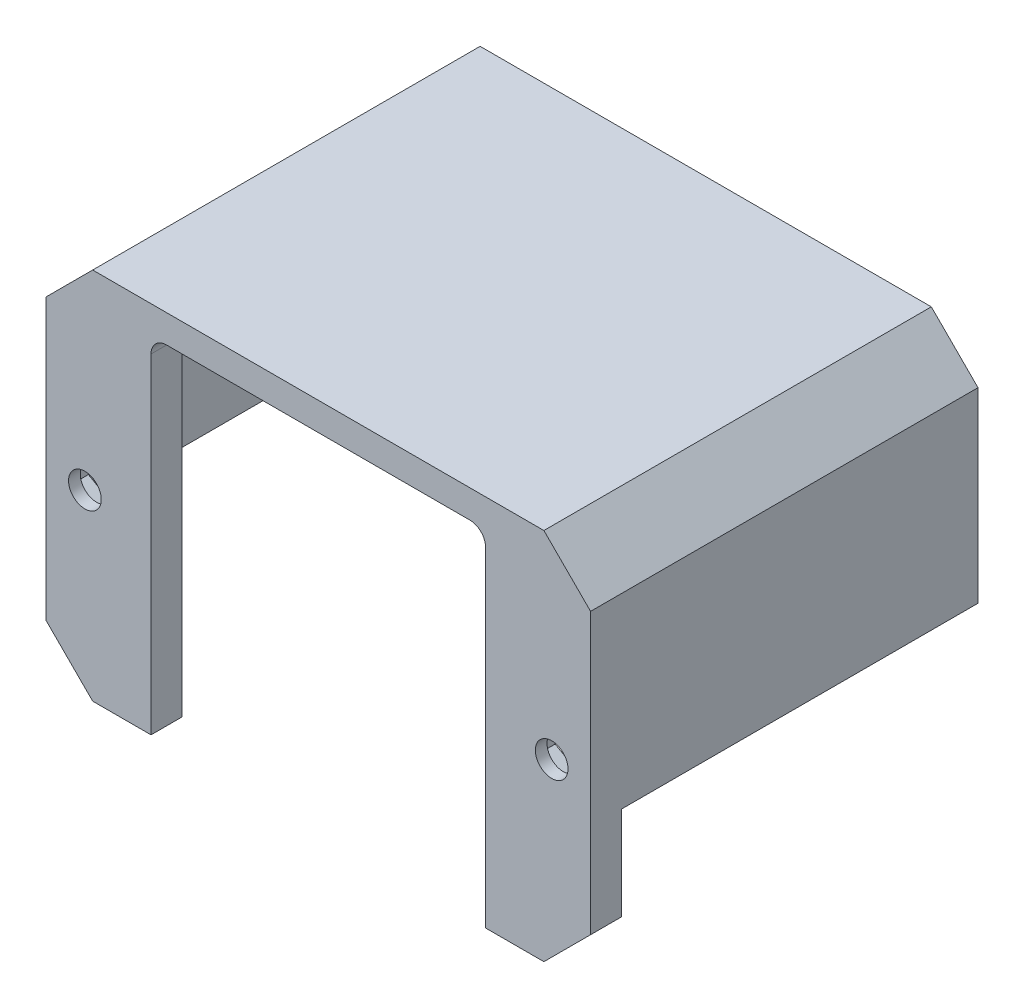
from build123d import *

# Parameters (mm, degrees)
SKETCH1_W           = 70
SKETCH1_H           = 48
SKETCH1_W_2         = 43
SKETCH1_H_2         = 42.8
BOSS_EXTRUDE1_DEPTH = 4
SKETCH2_W           = 10.268328243
SKETCH2_H           = 48
SKETCH2_R           = 2.1
SKETCH2_W_2         = 10.814622491
BOSS_EXTRUDE2_DEPTH = 1.5
CHAMFER1_SIZE       = 6
FILLET1_R           = 2
SKETCH3_W           = 43
SKETCH3_H           = 7.264710946
CUT_EXTRUDE1_DEPTH  = 10
BOSS_EXTRUDE3_DEPTH = 45.8
BOSS_EXTRUDE4_DEPTH = 1.2
CUT_EXTRUDE2_DEPTH  = 50


with BuildPart() as part:
    # Sketch1 → Boss-Extrude1 (new body)
    with BuildSketch(Plane(origin=(0, 0, 789.620141885), x_dir=(-1, 0, 0), z_dir=(0, 0, -1))):
        with Locations((-51.439156386, -559.298939869)):
            Rectangle(SKETCH1_W, SKETCH1_H)
        with Locations((-51.439156386, -560.298939869)):
            Rectangle(SKETCH1_W_2, SKETCH1_H_2, mode=Mode.SUBTRACT)
        Polygon((-84.989156386, -558.249346414), (-84.989156386, -562.348533325), (-81.439156386, -564.398126781), (-77.889156386, -562.348533325), (-77.889156386, -558.249346414), (-81.439156386, -556.199752958), align=None, mode=Mode.SUBTRACT)
        Polygon((-17.889156386, -562.348533325), (-17.889156386, -558.249346414), (-21.439156386, -556.199752958), (-24.989156386, -558.249346414), (-24.989156386, -562.348533325), (-21.439156386, -564.398126781), align=None, mode=Mode.SUBTRACT)
    extrude(amount=BOSS_EXTRUDE1_DEPTH)

    # Sketch2 → Boss-Extrude2 (add)
    # profile 1 of 2: a face of its own
    with BuildSketch(Plane.XY.offset(789.620141885)):
        with Locations((21.573320508, -559.298939869)):
            Rectangle(SKETCH2_W, SKETCH2_H)
        with Locations((21.439156386, -560.298939869)):
            Circle(SKETCH2_R, mode=Mode.SUBTRACT)
    # profile 2 of 2: a face of its own
    with BuildSketch(Plane.XY.offset(789.620141885)):
        with Locations((81.03184514, -559.298939869)):
            Rectangle(SKETCH2_W_2, SKETCH2_H)
        with Locations((81.439156386, -560.298939869)):
            Circle(SKETCH2_R, mode=Mode.SUBTRACT)
    extrude(amount=-BOSS_EXTRUDE2_DEPTH)

    # Chamfer1
    chamfer1_edges = [part.edges().sort_by_distance(p)[0] for p in [
        (86.439156386, -535.298939869, 787.620141885),
        (16.439156386, -535.298939869, 787.620141885),
        (16.439156386, -583.298939869, 787.620141885),
        (86.439156386, -583.298939869, 787.620141885),
    ]]
    chamfer(chamfer1_edges, length=CHAMFER1_SIZE)

    # Fillet1
    fillet1_edges = [part.edges().sort_by_distance(p)[0] for p in [
        (72.939156386, -538.898939869, 787.620141885),
        (29.939156386, -538.898939869, 787.620141885),
    ]]
    fillet(fillet1_edges, radius=FILLET1_R)

    # Sketch3 → Cut-Extrude1 (cut)
    with BuildSketch(Plane(origin=(0, 0, 785.620141885), x_dir=(-1, 0, 0), z_dir=(0, 0, -1))):
        with Locations((-51.439156386, -585.331295342)):
            Rectangle(SKETCH3_W, SKETCH3_H)
    extrude(amount=-CUT_EXTRUDE1_DEPTH, mode=Mode.SUBTRACT)

    # Sketch4 → Boss-Extrude3 (add)
    with BuildSketch(Plane(origin=(0, 0, 785.620141885), x_dir=(-1, 0, 0), z_dir=(0, 0, -1))):
        Polygon((-86.439156386, -577.298939869), (-86.439156386, -541.298939869), (-80.439156386, -535.298939869), (-22.439156386, -535.298939869), (-16.439156386, -541.298939869), (-16.439156386, -577.298939869), (-17.939156386, -577.298939869), (-17.939156386, -541.920260213), (-23.06047673, -536.798939869), (-79.817836043, -536.798939869), (-84.939156386, -541.920260213), (-84.939156386, -577.298939869), align=None)
    extrude(amount=BOSS_EXTRUDE3_DEPTH)

    # Sketch5 → Boss-Extrude4 (add)
    with BuildSketch(Plane(origin=(0, 0, 739.820141885), x_dir=(-1, 0, 0), z_dir=(0, 0, -1))):
        Polygon((-86.439156386, -559.298939869), (-86.439156386, -541.298939869), (-80.439156386, -535.298939869), (-22.439156386, -535.298939869), (-16.439156386, -541.298939869), (-16.439156386, -559.298939869), (-16.439156386, -565.298939869), (-86.439156386, -565.298939869), align=None)
    extrude(amount=-BOSS_EXTRUDE4_DEPTH)

    # Sketch6 → Cut-Extrude2 (cut)
    with BuildSketch(Plane(origin=(0, 0, 785.620141885), x_dir=(-1, 0, 0), z_dir=(0, 0, -1))):
        Polygon((-17.939156386, -565.298939869), (-100.122525481, -565.298939869), (-100.122525481, -581.771183043), (-17.939156386, -581.771183043), (-3.612614588, -581.771183043), (-3.612614588, -565.298939869), align=None)
    extrude(amount=CUT_EXTRUDE2_DEPTH, mode=Mode.SUBTRACT)


solid = part.part
